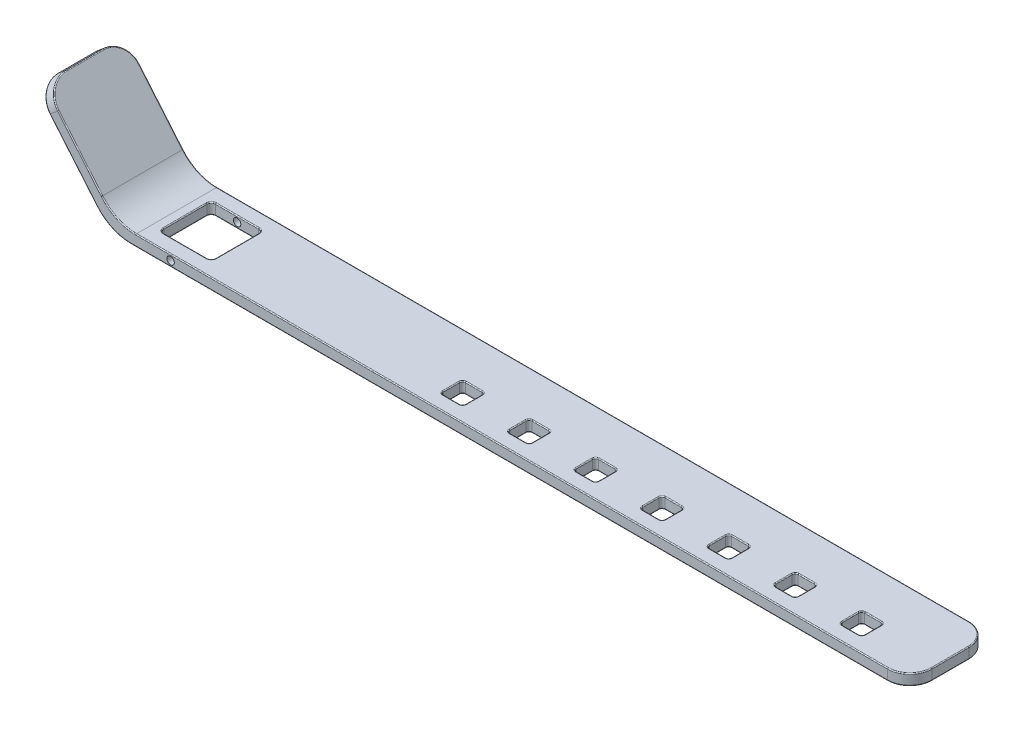
from build123d import *

# Parameters (mm, degrees)
BOSS_EXTRUDE1_DEPTH      = 11
BOSS_EXTRUDE1_DEPTH_BACK = 11
SKETCH1_R                = 1
FILLET1_R                = 6
CUT_EXTRUDE1_REACH       = 124.675
FILLET2_R                = 0.25


with BuildPart() as part:
    # Sketch1 → Boss-Extrude1 (new, two sides: drawn at the far end of the back side and taken through both)
    with BuildSketch(Plane.XY.offset(-BOSS_EXTRUDE1_DEPTH_BACK)):
        with BuildLine():
            Line((-98.59684142, 5.786548684), (-114.283628291, 24.481333294))
            Line((-114.283628291, 24.481333294), (-116.58176162, 22.552970465))
            Line((-116.58176162, 22.552970465), (-99.995764394, 2.786548684))
            ThreePointArc((-99.995764394, 2.786548684), (-95.874650217, -0.375693444), (-90.803231077, -1.5))
            Line((-90.803231077, -1.5), (120, -1.5))
            Line((120, -1.5), (120, 1.5))
            Line((120, 1.5), (-89.404308102, 1.5))
            ThreePointArc((-89.404308102, 1.5), (-94.475727243, 2.624306556), (-98.59684142, 5.786548684))
        make_face()
        with Locations((-80, 0)):
            Circle(SKETCH1_R, mode=Mode.SUBTRACT)
    extrude(amount=BOSS_EXTRUDE1_DEPTH + BOSS_EXTRUDE1_DEPTH_BACK)

    # Fillet1
    fillet1_edges = [part.edges().sort_by_distance(p)[0] for p in [
        (-115.432694955, 23.517151879, -11),
        (120, 0, 11),
        (-115.432694955, 23.517151879, 11),
        (120, 0, -11),
    ]]
    fillet(fillet1_edges, radius=FILLET1_R)

    # Sketch2 → Cut-Extrude1 (cut, up to next)
    with BuildSketch(Plane(origin=(0, 1.5, 0), x_dir=(1, 0, 0), z_dir=(0, 1, 0)), mode=Mode.PRIVATE) as cut_extrude1_sk1:
        with BuildLine():
            Line((-85.8, 7), (-74.2, 7))
            ThreePointArc((-74.2, 7), (-73.351471863, 6.648528137), (-73, 5.8))
            Line((-73, 5.8), (-73, -5.8))
            ThreePointArc((-73, -5.8), (-73.351471863, -6.648528137), (-74.2, -7))
            Line((-74.2, -7), (-85.8, -7))
            ThreePointArc((-85.8, -7), (-86.648528137, -6.648528137), (-87, -5.8))
            Line((-87, -5.8), (-87, 5.8))
            ThreePointArc((-87, 5.8), (-86.648528137, 6.648528137), (-85.8, 7))
        make_face()
    cut_extrude1_tool1 = extrude(cut_extrude1_sk1.sketch, amount=-CUT_EXTRUDE1_REACH, mode=Mode.PRIVATE) & part.part
    # Sketch2 → Cut-Extrude1 (cut, up to next)
    with BuildSketch(Plane(origin=(0, 1.5, 0), x_dir=(1, 0, 0), z_dir=(0, 1, 0)), mode=Mode.PRIVATE) as cut_extrude1_sk2:
        with BuildLine():
            Line((79.8, -1), (84.2, -1))
            ThreePointArc((84.2, -1), (84.765685425, -1.234314575), (85, -1.8))
            Line((85, -1.8), (85, -6.2))
            ThreePointArc((85, -6.2), (84.765685425, -6.765685425), (84.2, -7))
            Line((84.2, -7), (79.8, -7))
            ThreePointArc((79.8, -7), (79.234314575, -6.765685425), (79, -6.2))
            Line((79, -6.2), (79, -1.8))
            ThreePointArc((79, -1.8), (79.234314575, -1.234314575), (79.8, -1))
        make_face()
    cut_extrude1_tool2 = extrude(cut_extrude1_sk2.sketch, amount=-CUT_EXTRUDE1_REACH, mode=Mode.PRIVATE) & part.part
    # Sketch2 → Cut-Extrude1 (cut, up to next)
    with BuildSketch(Plane(origin=(0, 1.5, 0), x_dir=(1, 0, 0), z_dir=(0, 1, 0)), mode=Mode.PRIVATE) as cut_extrude1_sk3:
        with BuildLine():
            Line((97.8, -1), (102.2, -1))
            ThreePointArc((102.2, -1), (102.765685425, -1.234314575), (103, -1.8))
            Line((103, -1.8), (103, -6.2))
            ThreePointArc((103, -6.2), (102.765685425, -6.765685425), (102.2, -7))
            Line((102.2, -7), (97.8, -7))
            ThreePointArc((97.8, -7), (97.234314575, -6.765685425), (97, -6.2))
            Line((97, -6.2), (97, -1.8))
            ThreePointArc((97, -1.8), (97.234314575, -1.234314575), (97.8, -1))
        make_face()
    cut_extrude1_tool3 = extrude(cut_extrude1_sk3.sketch, amount=-CUT_EXTRUDE1_REACH, mode=Mode.PRIVATE) & part.part
    # Sketch2 → Cut-Extrude1 (cut, up to next)
    with BuildSketch(Plane(origin=(0, 1.5, 0), x_dir=(1, 0, 0), z_dir=(0, 1, 0)), mode=Mode.PRIVATE) as cut_extrude1_sk4:
        with BuildLine():
            Line((61.8, -1), (66.2, -1))
            ThreePointArc((66.2, -1), (66.765685425, -1.234314575), (67, -1.8))
            Line((67, -1.8), (67, -6.2))
            ThreePointArc((67, -6.2), (66.765685425, -6.765685425), (66.2, -7))
            Line((66.2, -7), (61.8, -7))
            ThreePointArc((61.8, -7), (61.234314575, -6.765685425), (61, -6.2))
            Line((61, -6.2), (61, -1.8))
            ThreePointArc((61, -1.8), (61.234314575, -1.234314575), (61.8, -1))
        make_face()
    cut_extrude1_tool4 = extrude(cut_extrude1_sk4.sketch, amount=-CUT_EXTRUDE1_REACH, mode=Mode.PRIVATE) & part.part
    # Sketch2 → Cut-Extrude1 (cut, up to next)
    with BuildSketch(Plane(origin=(0, 1.5, 0), x_dir=(1, 0, 0), z_dir=(0, 1, 0)), mode=Mode.PRIVATE) as cut_extrude1_sk5:
        with BuildLine():
            Line((43.8, -1), (48.2, -1))
            ThreePointArc((48.2, -1), (48.765685425, -1.234314575), (49, -1.8))
            Line((49, -1.8), (49, -6.2))
            ThreePointArc((49, -6.2), (48.765685425, -6.765685425), (48.2, -7))
            Line((48.2, -7), (43.8, -7))
            ThreePointArc((43.8, -7), (43.234314575, -6.765685425), (43, -6.2))
            Line((43, -6.2), (43, -1.8))
            ThreePointArc((43, -1.8), (43.234314575, -1.234314575), (43.8, -1))
        make_face()
    cut_extrude1_tool5 = extrude(cut_extrude1_sk5.sketch, amount=-CUT_EXTRUDE1_REACH, mode=Mode.PRIVATE) & part.part
    # Sketch2 → Cut-Extrude1 (cut, up to next)
    with BuildSketch(Plane(origin=(0, 1.5, 0), x_dir=(1, 0, 0), z_dir=(0, 1, 0)), mode=Mode.PRIVATE) as cut_extrude1_sk6:
        with BuildLine():
            Line((25.8, -1), (30.2, -1))
            ThreePointArc((30.2, -1), (30.765685425, -1.234314575), (31, -1.8))
            Line((31, -1.8), (31, -6.2))
            ThreePointArc((31, -6.2), (30.765685425, -6.765685425), (30.2, -7))
            Line((30.2, -7), (25.8, -7))
            ThreePointArc((25.8, -7), (25.234314575, -6.765685425), (25, -6.2))
            Line((25, -6.2), (25, -1.8))
            ThreePointArc((25, -1.8), (25.234314575, -1.234314575), (25.8, -1))
        make_face()
    cut_extrude1_tool6 = extrude(cut_extrude1_sk6.sketch, amount=-CUT_EXTRUDE1_REACH, mode=Mode.PRIVATE) & part.part
    # Sketch2 → Cut-Extrude1 (cut, up to next)
    with BuildSketch(Plane(origin=(0, 1.5, 0), x_dir=(1, 0, 0), z_dir=(0, 1, 0)), mode=Mode.PRIVATE) as cut_extrude1_sk7:
        with BuildLine():
            Line((7.8, -1), (12.2, -1))
            ThreePointArc((12.2, -1), (12.765685425, -1.234314575), (13, -1.8))
            Line((13, -1.8), (13, -6.2))
            ThreePointArc((13, -6.2), (12.765685425, -6.765685425), (12.2, -7))
            Line((12.2, -7), (7.8, -7))
            ThreePointArc((7.8, -7), (7.234314575, -6.765685425), (7, -6.2))
            Line((7, -6.2), (7, -1.8))
            ThreePointArc((7, -1.8), (7.234314575, -1.234314575), (7.8, -1))
        make_face()
    cut_extrude1_tool7 = extrude(cut_extrude1_sk7.sketch, amount=-CUT_EXTRUDE1_REACH, mode=Mode.PRIVATE) & part.part
    # Sketch2 → Cut-Extrude1 (cut, up to next)
    with BuildSketch(Plane(origin=(0, 1.5, 0), x_dir=(1, 0, 0), z_dir=(0, 1, 0)), mode=Mode.PRIVATE) as cut_extrude1_sk8:
        with BuildLine():
            Line((-10.2, -1), (-5.8, -1))
            ThreePointArc((-5.8, -1), (-5.234314575, -1.234314575), (-5, -1.8))
            Line((-5, -1.8), (-5, -6.2))
            ThreePointArc((-5, -6.2), (-5.234314575, -6.765685425), (-5.8, -7))
            Line((-5.8, -7), (-10.2, -7))
            ThreePointArc((-10.2, -7), (-10.765685425, -6.765685425), (-11, -6.2))
            Line((-11, -6.2), (-11, -1.8))
            ThreePointArc((-11, -1.8), (-10.765685425, -1.234314575), (-10.2, -1))
        make_face()
    cut_extrude1_tool8 = extrude(cut_extrude1_sk8.sketch, amount=-CUT_EXTRUDE1_REACH, mode=Mode.PRIVATE) & part.part
    add(cut_extrude1_tool1.solids().sort_by_distance((-80, 1.5, 0))[0], mode=Mode.SUBTRACT)
    add(cut_extrude1_tool2.solids().sort_by_distance((82, 1.5, 4))[0], mode=Mode.SUBTRACT)
    add(cut_extrude1_tool3.solids().sort_by_distance((100, 1.5, 4))[0], mode=Mode.SUBTRACT)
    add(cut_extrude1_tool4.solids().sort_by_distance((64, 1.5, 4))[0], mode=Mode.SUBTRACT)
    add(cut_extrude1_tool5.solids().sort_by_distance((46, 1.5, 4))[0], mode=Mode.SUBTRACT)
    add(cut_extrude1_tool6.solids().sort_by_distance((28, 1.5, 4))[0], mode=Mode.SUBTRACT)
    add(cut_extrude1_tool7.solids().sort_by_distance((10, 1.5, 4))[0], mode=Mode.SUBTRACT)
    add(cut_extrude1_tool8.solids().sort_by_distance((-8, 1.5, 4))[0], mode=Mode.SUBTRACT)

    # Fillet2
    fillet2_edges = [part.edges().sort_by_distance(p)[0] for p in [
        (-94.475727243, 2.624306556, -11),
        (-80, -1.5, -7),
        (-80, -1.5, 7),
        (-86.648528137, -1.5, 6.648528137),
        (-87, -1.5, 0),
        (-86.648528137, -1.5, -6.648528137),
        (-73.351471863, -1.5, -6.648528137),
        (-73, -1.5, 0),
        (-73.351471863, -1.5, 6.648528137),
        (-86.648528137, 1.5, 6.648528137),
        (-80, 1.5, 7),
        (-73.351471863, 1.5, 6.648528137),
        (-73, 1.5, 0),
        (-73.351471863, 1.5, -6.648528137),
        (-80, 1.5, -7),
        (-86.648528137, 1.5, -6.648528137),
        (-87, 1.5, 0),
        (102.765685425, -1.5, 1.234314575),
        (103, -1.5, 4),
        (102.765685425, -1.5, 6.765685425),
        (100, -1.5, 7),
        (97.234314575, -1.5, 6.765685425),
        (97, -1.5, 4),
        (97.234314575, -1.5, 1.234314575),
        (100, -1.5, 1),
        (102.765685425, 1.5, 1.234314575),
        (100, 1.5, 1),
        (97.234314575, 1.5, 1.234314575),
        (97, 1.5, 4),
        (97.234314575, 1.5, 6.765685425),
        (100, 1.5, 7),
        (102.765685425, 1.5, 6.765685425),
        (103, 1.5, 4),
        (84.765685425, -1.5, 1.234314575),
        (85, -1.5, 4),
        (84.765685425, -1.5, 6.765685425),
        (82, -1.5, 7),
        (79.234314575, -1.5, 6.765685425),
        (79, -1.5, 4),
        (79.234314575, -1.5, 1.234314575),
        (82, -1.5, 1),
        (84.765685425, 1.5, 1.234314575),
        (82, 1.5, 1),
        (79.234314575, 1.5, 1.234314575),
        (79, 1.5, 4),
        (79.234314575, 1.5, 6.765685425),
        (82, 1.5, 7),
        (84.765685425, 1.5, 6.765685425),
        (85, 1.5, 4),
        (66.765685425, -1.5, 1.234314575),
        (67, -1.5, 4),
        (66.765685425, -1.5, 6.765685425),
        (64, -1.5, 7),
        (61.234314575, -1.5, 6.765685425),
        (61, -1.5, 4),
        (61.234314575, -1.5, 1.234314575),
        (64, -1.5, 1),
        (66.765685425, 1.5, 1.234314575),
        (64, 1.5, 1),
        (61.234314575, 1.5, 1.234314575),
        (61, 1.5, 4),
        (61.234314575, 1.5, 6.765685425),
        (64, 1.5, 7),
        (66.765685425, 1.5, 6.765685425),
        (67, 1.5, 4),
        (48.765685425, -1.5, 1.234314575),
        (49, -1.5, 4),
        (48.765685425, -1.5, 6.765685425),
        (46, -1.5, 7),
        (-104.511872026, 12.835807659, -11),
        (43.234314575, -1.5, 6.765685425),
        (43, -1.5, 4),
        (43.234314575, -1.5, 1.234314575),
        (46, -1.5, 1),
        (48.765685425, 1.5, 1.234314575),
        (46, 1.5, 1),
        (43.234314575, 1.5, 1.234314575),
        (43, 1.5, 4),
        (43.234314575, 1.5, 6.765685425),
        (46, 1.5, 7),
        (48.765685425, 1.5, 6.765685425),
        (49, 1.5, 4),
        (30.765685425, -1.5, 1.234314575),
        (31, -1.5, 4),
        (30.765685425, -1.5, 6.765685425),
        (28, -1.5, 7),
        (25.234314575, -1.5, 6.765685425),
        (25, -1.5, 4),
        (25.234314575, -1.5, 1.234314575),
        (28, -1.5, 1),
        (30.765685425, 1.5, 1.234314575),
        (28, 1.5, 1),
        (25.234314575, 1.5, 1.234314575),
        (25, 1.5, 4),
        (25.234314575, 1.5, 6.765685425),
        (28, 1.5, 7),
        (30.765685425, 1.5, 6.765685425),
        (31, 1.5, 4),
        (12.765685425, -1.5, 1.234314575),
        (13, -1.5, 4),
        (12.765685425, -1.5, 6.765685425),
        (10, -1.5, 7),
        (7.234314575, -1.5, 6.765685425),
        (7, -1.5, 4),
        (7.234314575, -1.5, 1.234314575),
        (10, -1.5, 1),
        (12.765685425, 1.5, 1.234314575),
        (10, 1.5, 1),
        (7.234314575, 1.5, 1.234314575),
        (7, 1.5, 4),
        (7.234314575, 1.5, 6.765685425),
        (10, 1.5, 7),
        (12.765685425, 1.5, 6.765685425),
        (13, 1.5, 4),
        (-5.234314575, -1.5, 1.234314575),
        (-5, -1.5, 4),
        (-5.234314575, -1.5, 6.765685425),
        (-8, -1.5, 7),
        (-10.765685425, -1.5, 6.765685425),
        (-11, -1.5, 4),
        (-10.765685425, -1.5, 1.234314575),
        (-8, -1.5, 1),
        (-5.234314575, 1.5, 1.234314575),
        (-8, 1.5, 1),
        (-10.765685425, 1.5, 1.234314575),
        (-11, 1.5, 4),
        (-10.765685425, 1.5, 6.765685425),
        (-8, 1.5, 7),
        (-5.234314575, 1.5, 6.765685425),
        (-5, 1.5, 4),
        (-94.475727243, 2.624306556, 11),
        (-104.511872026, 12.835807659, 11),
        (-95.874650217, -0.375693444, 11),
        (11.598384462, -1.5, 11),
        (-95.874650217, -0.375693444, -11),
        (11.598384462, -1.5, -11),
        (12.297845949, 1.5, 11),
        (-106.360400178, 10.371626245, 11),
        (120, 1.5, 0),
        (12.297845949, 1.5, -11),
        (118.242640687, 1.5, -9.242640687),
        (118.242640687, 1.5, 9.242640687),
        (120, -1.5, 0),
        (118.242640687, -1.5, -9.242640687),
        (118.242640687, -1.5, 9.242640687),
        (-106.360400178, 10.371626245, -11),
        (-116.58176162, 22.552970465, 0),
        (-114.283628291, 24.481333294, 0),
        (-115.452152828, 21.206755128, 9.242640687),
        (-115.452152828, 21.206755128, -9.242640687),
        (-113.154019499, 23.135117957, 9.242640687),
        (-113.154019499, 23.135117957, -9.242640687),
    ]]
    fillet(fillet2_edges, radius=FILLET2_R)


solid = part.part
